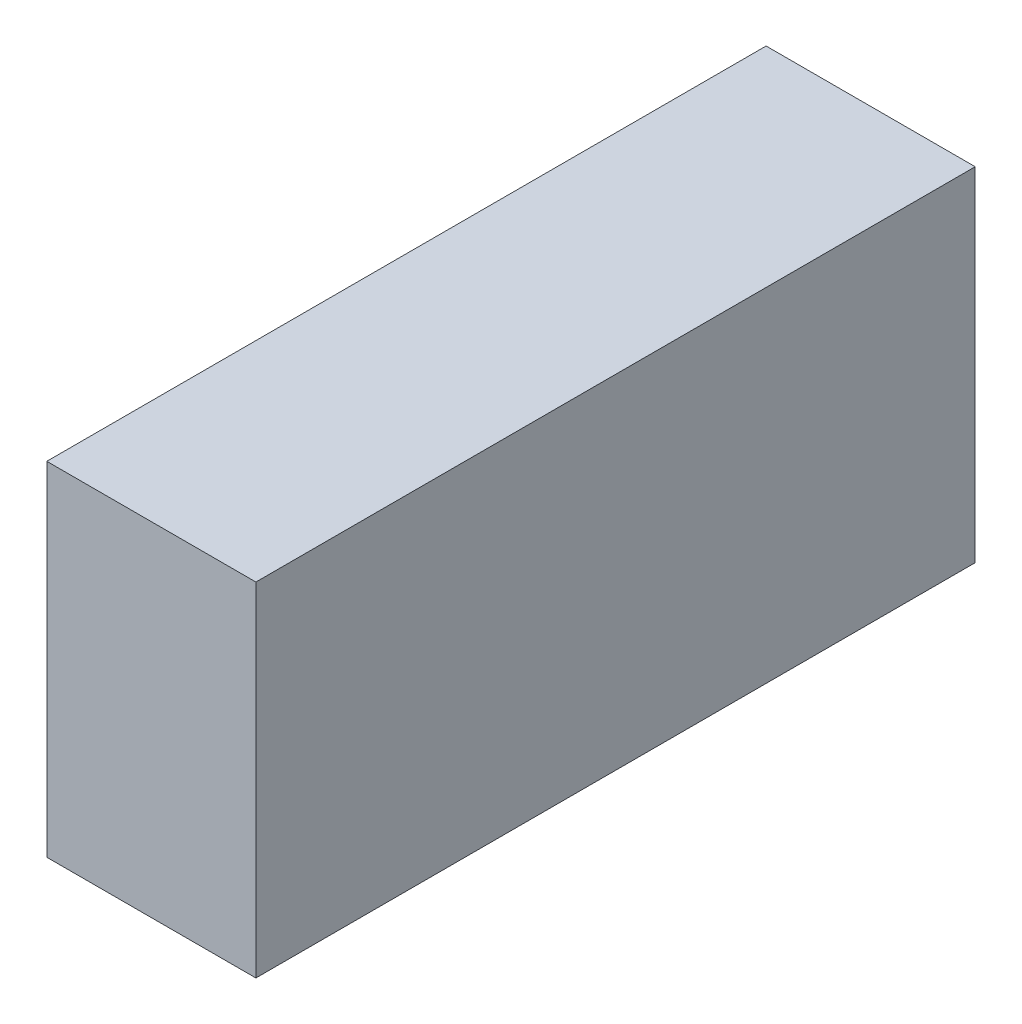
from build123d import *

# Parameters (mm, degrees)
SKETCH1_W           = 12.5
SKETCH1_H           = 20.5
BOSS_EXTRUDE1_DEPTH = 43


with BuildPart() as part:
    # Sketch1 → Boss-Extrude1 (new body)
    with BuildSketch(Plane.XY):
        with Locations((6.25, 10.25)):
            Rectangle(SKETCH1_W, SKETCH1_H)
    extrude(amount=BOSS_EXTRUDE1_DEPTH)


solid = part.part
